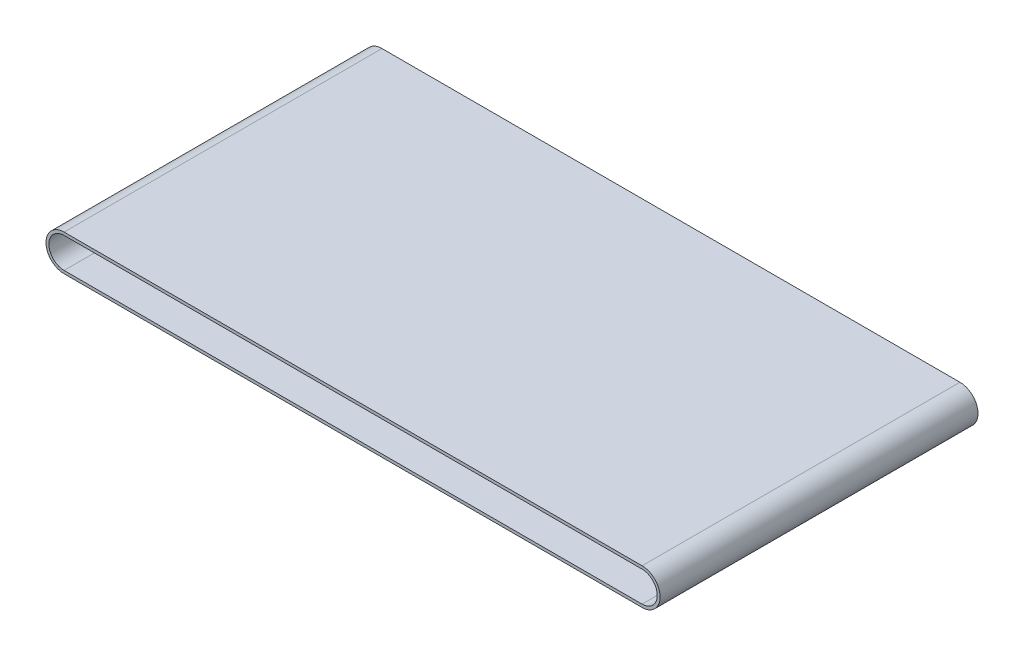
from build123d import *

# Parameters (mm, degrees)
BOSS_EXTRU_1_DEPTH      = 139.7
ENL_V_MAT_EXTRU_1_REACH = 390.779


with BuildPart() as part:
    # Esquisse1 → Boss.-Extru.1 (new, symmetric)
    with BuildSketch(Plane.XY):
        with BuildLine():
            Line((-254, 15.875), (254, 15.875))
            ThreePointArc((254, 15.875), (269.875, 0), (254, -15.875))
            Line((254, -15.875), (-254, -15.875))
            ThreePointArc((-254, -15.875), (-269.875, 0), (-254, 15.875))
        make_face()
    extrude(amount=BOSS_EXTRU_1_DEPTH, both=True)

    # Esquisse2 → Enlèv. mat.-Extru.1 (cut, up to next)
    with BuildSketch(Plane.XY.offset(139.7), mode=Mode.PRIVATE) as enl_v_mat_extru_1_sk1:
        with BuildLine():
            Line((-254, 13.335), (254, 13.335))
            ThreePointArc((254, 13.335), (267.335, 0), (254, -13.335))
            Line((254, -13.335), (-254, -13.335))
            ThreePointArc((-254, -13.335), (-267.335, 0), (-254, 13.335))
        make_face()
    enl_v_mat_extru_1_tool1 = extrude(enl_v_mat_extru_1_sk1.sketch, amount=-ENL_V_MAT_EXTRU_1_REACH, mode=Mode.PRIVATE) & part.part
    add(enl_v_mat_extru_1_tool1.solids().sort_by_distance((0, 0, 139.7))[0], mode=Mode.SUBTRACT)


solid = part.part
